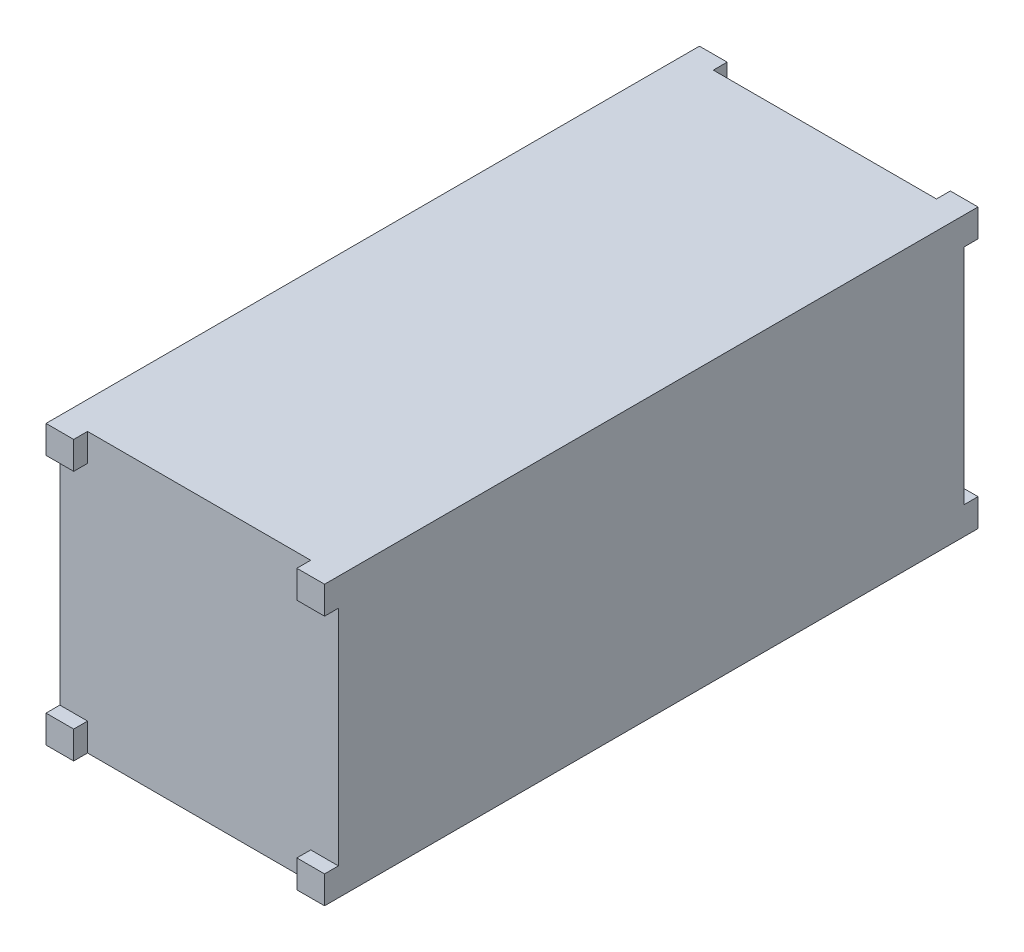
from build123d import *

# Parameters (mm, degrees)
SKETCH1_W           = 100.6
SKETCH1_H           = 100.6
BOSS_EXTRUDE1_DEPTH = 113
SKETCH2_W           = 10
SKETCH2_H           = 10
BOSS_EXTRUDE2_DEPTH = 5
SKETCH3_W           = 10
SKETCH3_H           = 10
BOSS_EXTRUDE3_DEPTH = 5


with BuildPart() as part:
    # Sketch1 → Boss-Extrude1 (new, symmetric)
    with BuildSketch(Plane.XY):
        Rectangle(SKETCH1_W, SKETCH1_H)
    extrude(amount=BOSS_EXTRUDE1_DEPTH, both=True)

    # Sketch2 → Boss-Extrude2 (add)
    with BuildSketch(Plane.XY.offset(113)):
        with Locations((-45.3, 45.3)):
            Rectangle(SKETCH2_W, SKETCH2_H)
        with Locations((45.3, 45.3)):
            Rectangle(SKETCH2_W, SKETCH2_H)
        with Locations((45.3, -45.3)):
            Rectangle(SKETCH2_W, SKETCH2_H)
        with Locations((-45.3, -45.3)):
            Rectangle(SKETCH2_W, SKETCH2_H)
    extrude(amount=BOSS_EXTRUDE2_DEPTH)

    # Sketch3 → Boss-Extrude3 (add)
    with BuildSketch(Plane(origin=(0, 0, -113), x_dir=(-1, 0, 0), z_dir=(0, 0, -1))):
        with Locations((-45.3, 45.3)):
            Rectangle(SKETCH3_W, SKETCH3_H)
        with Locations((45.3, 45.3)):
            Rectangle(SKETCH3_W, SKETCH3_H)
        with Locations((45.3, -45.3)):
            Rectangle(SKETCH3_W, SKETCH3_H)
        with Locations((-45.3, -45.3)):
            Rectangle(SKETCH3_W, SKETCH3_H)
    extrude(amount=BOSS_EXTRUDE3_DEPTH)


solid = part.part
